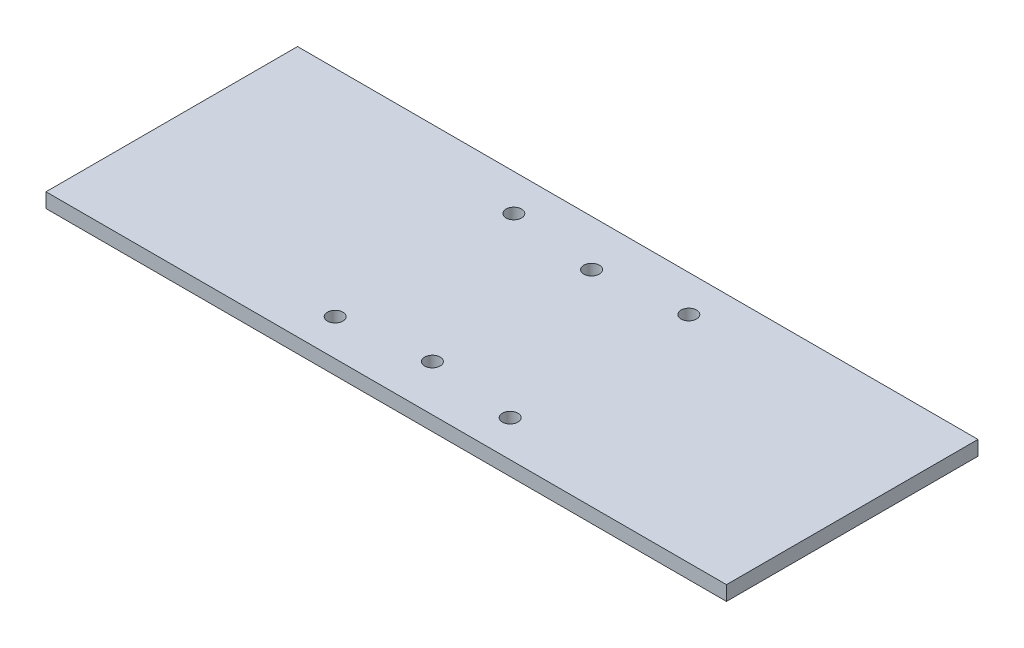
from build123d import *

# Parameters (mm, degrees)
SKETCH_1_W               = 140
SKETCH_1_H               = 51.75
EXTRUDE_1_DEPTH          = 3
CUT_EXTRUDE_1_DEPTH      = 111.909649071
CUT_EXTRUDE_1_DEPTH_BACK = 111.909649071
SKETCH_2_R               = 1.6
SKETCH_3_R               = 1.6
CUT_EXTRUDE_2_DEPTH      = 10


with BuildPart() as part:
    # 草图1 → 凸台-拉伸1 (new body)
    with BuildSketch(Plane(origin=(0, 0, 0), x_dir=(1, 0, 0), z_dir=(0, 1, 0))):
        with Locations((28.050434762, 25.875)):
            Rectangle(SKETCH_1_W, SKETCH_1_H)
    extrude(amount=EXTRUDE_1_DEPTH)

    # 草图2 → 切除-拉伸1 (cut, two sides: drawn at the far end of the back side and taken through both)
    with BuildSketch(Plane(origin=(0, 3, 0), x_dir=(1, 0, 0), z_dir=(0, 1, 0)).offset(-CUT_EXTRUDE_1_DEPTH_BACK)):
        with Locations(Location((28.050434762, 9.5, 0), (0, 0, 270))):
            Circle(SKETCH_2_R)
        with Locations(Location((46.050434762, 7.5, 0), (0, 0, 270))):
            Circle(SKETCH_2_R)
        with Locations(Location((10.050434762, 7.5, 0), (0, 0, 270))):
            Circle(SKETCH_2_R)
    extrude(amount=CUT_EXTRUDE_1_DEPTH + CUT_EXTRUDE_1_DEPTH_BACK, mode=Mode.SUBTRACT)

    # 草图3 → 切除-拉伸2 (cut)
    with BuildSketch(Plane(origin=(0, 3, 0), x_dir=(1, 0, 0), z_dir=(0, 1, 0))):
        with Locations(Location((10.050434762, 44.25, 0), (0, 0, 270))):
            Circle(SKETCH_3_R)
        with Locations(Location((28.050434762, 42.25, 0), (0, 0, 270))):
            Circle(SKETCH_3_R)
        with Locations(Location((46.050434762, 44.25, 0), (0, 0, 270))):
            Circle(SKETCH_3_R)
    extrude(amount=-CUT_EXTRUDE_2_DEPTH, mode=Mode.SUBTRACT)


solid = part.part
